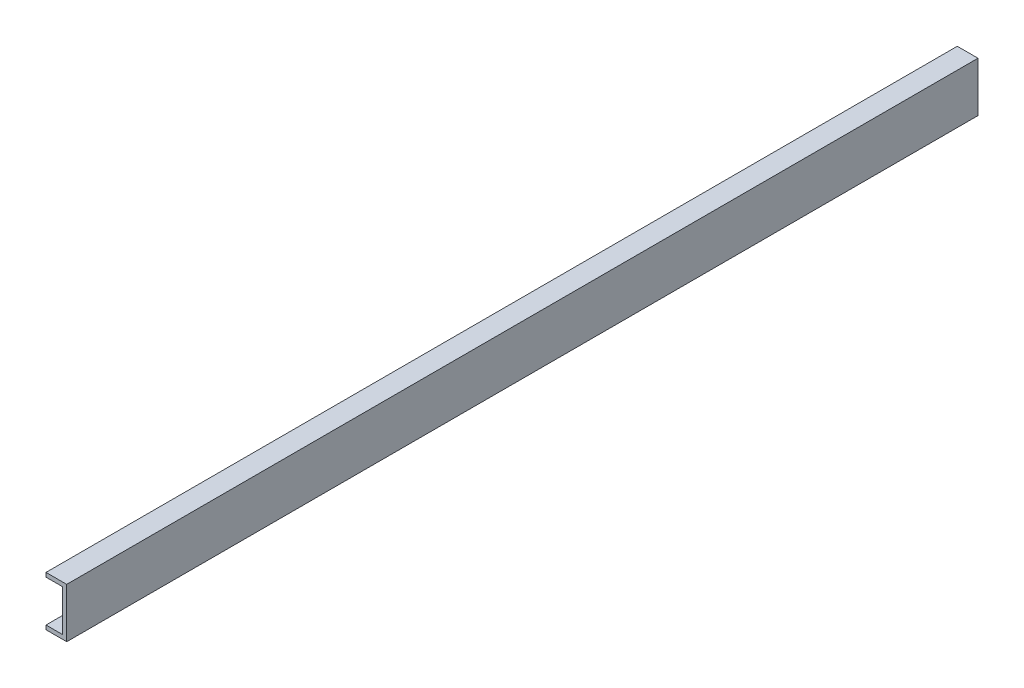
from build123d import *

# Parameters (mm, degrees)
SKETCH1_W           = 12.7
SKETCH1_H           = 30.48
BOSS_EXTRUDE1_DEPTH = 558.8
SKETCH2_W           = 10.16
SKETCH2_H           = 25.4
CUT_EXTRUDE1_DEPTH  = 560.043844524


with BuildPart() as part:
    # Sketch1 → Boss-Extrude1 (new body)
    with BuildSketch(Plane.XY):
        Rectangle(SKETCH1_W, SKETCH1_H)
    extrude(amount=BOSS_EXTRUDE1_DEPTH)

    # Sketch2 → Cut-Extrude1 (cut, through all)
    with BuildSketch(Plane.XY.offset(558.8)):
        with Locations((-1.27, 0)):
            Rectangle(SKETCH2_W, SKETCH2_H)
    extrude(amount=-CUT_EXTRUDE1_DEPTH, mode=Mode.SUBTRACT)


solid = part.part
